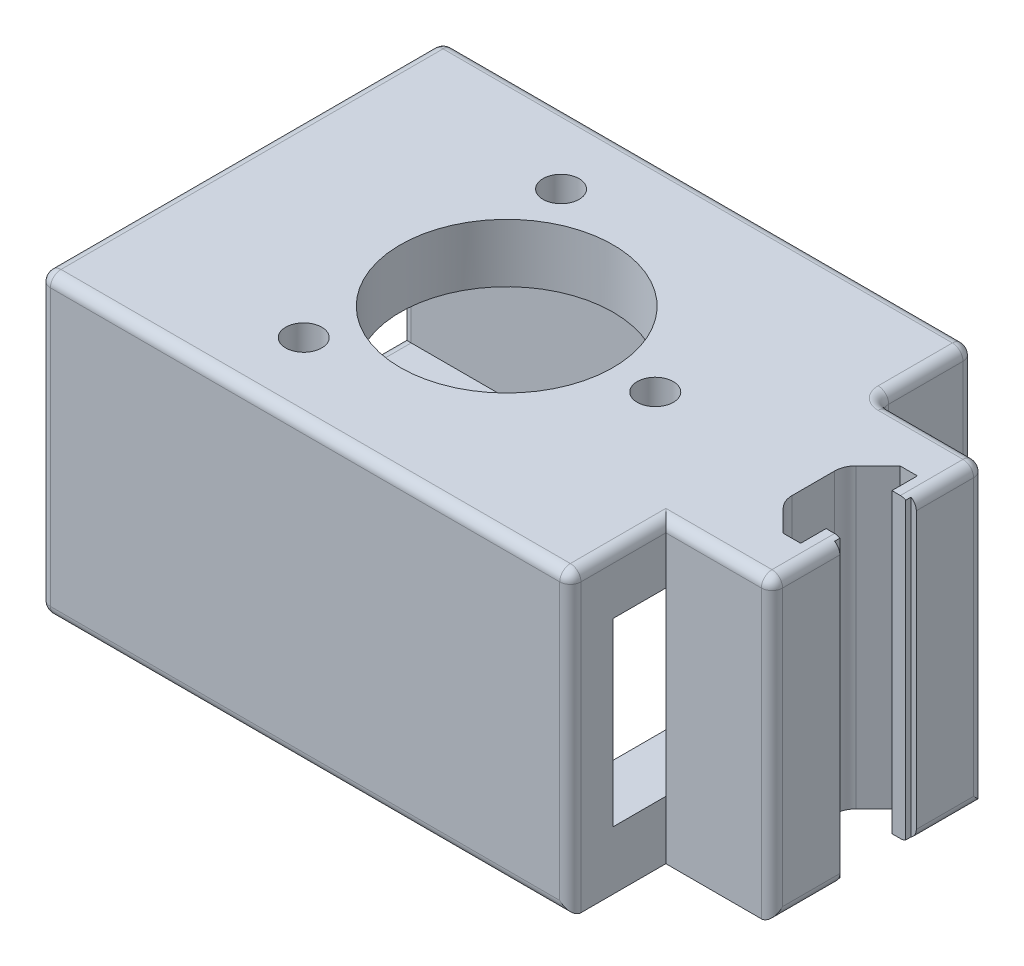
from build123d import *

# Parameters (mm, degrees)
SKETCH2_W                      = 30
SKETCH2_H                      = 17
BOSS_EXTRUDE1_DEPTH            = 50
CUT_EXTRUDE4_REACH             = 64.33
SKETCH7_R                      = 10.025
F_3_0MM_DOWEL_HOLE1_D          = 3.4
F_3_0MM_DOWEL_HOLE1_DEPTH      = 5.5
BOSS_EXTRUDE2_REACH            = 62.374
FILLET1_R                      = 1
CUT_EXTRUDE7_REACH             = 70.884
SKETCH13_W                     = 33.931840249
SKETCH13_H                     = 30
CUT_EXTRUDE7_DIRECTION_2_DEPTH = 10


with BuildPart() as part:
    # Sketch2 → Boss-Extrude1 (new body)
    with BuildSketch(Plane(origin=(0, 0, 0), x_dir=(0, 0, -1), z_dir=(1, 0, 0))):
        Polygon((19, -14), (3.999996995, -14), (0, -17.999996995), (-3.999996995, -14), (-19, -14), (-19, 14), (19, 14), align=None)
        Rectangle(SKETCH2_W, SKETCH2_H, mode=Mode.SUBTRACT)
    extrude(amount=BOSS_EXTRUDE1_DEPTH)

    # Sketch7 → Cut-Extrude4 (cut, up to next)
    with BuildSketch(Plane(origin=(0, 14, 0), x_dir=(1, 0, 0), z_dir=(0, 1, 0)), mode=Mode.PRIVATE) as cut_extrude4_sk1:
        with Locations(Location((25, 0, 0), (0, 0, 270))):
            Circle(SKETCH7_R)
    cut_extrude4_tool1 = extrude(cut_extrude4_sk1.sketch, amount=-CUT_EXTRUDE4_REACH, mode=Mode.PRIVATE) & part.part
    add(cut_extrude4_tool1.solids().sort_by_distance((25, 14, 0))[0], mode=Mode.SUBTRACT)

    # Ø3.0mm Dowel Hole1
    with Locations(Plane(origin=(0, 14, 0), x_dir=(1, 0, 0), z_dir=(0, 1, 0))):
        with Locations((18, -12.124355653), (18, 12.124355653), (39, 0)):
            Hole(F_3_0MM_DOWEL_HOLE1_D / 2, depth=F_3_0MM_DOWEL_HOLE1_DEPTH)

    # Boss-Extrude2: up to this face of the body (flat: up to its plane)
    boss_extrude2_end = Plane(part.part.faces().sort_by_distance((25, 14, 18.371987261))[0])
    # Sketch6 → Boss-Extrude2 (add, up to the picked face)
    with BuildSketch(Plane(origin=(0, -14, 0), x_dir=(1, 0, 0), z_dir=(0, 1, 0)), mode=Mode.PRIVATE) as boss_extrude2_sk1:
        with BuildLine():
            Line((60, 3.6), (59.5, 3.6))
            Line((59.5, 3.6), (59.5, 3.1))
            Line((59.5, 3.1), (58.2, 3.1))
            Line((58.2, 3.1), (58.2, 5.5))
            Line((58.2, 5.5), (56.560660172, 5.5))
            Line((56.560660172, 5.5), (54.485786438, 3.425126266))
            ThreePointArc((54.485786438, 3.425126266), (54.052240935, 2.776279568), (53.9, 2.010912703))
            Line((53.9, 2.010912703), (53.9, -2.010912703))
            ThreePointArc((53.9, -2.010912703), (54.052240935, -2.776279568), (54.485786438, -3.425126266))
            Line((54.485786438, -3.425126266), (56.560660172, -5.5))
            Line((56.560660172, -5.5), (58.2, -5.5))
            Line((58.2, -5.5), (58.2, -3.1))
            Line((58.2, -3.1), (59.5, -3.1))
            Line((59.5, -3.1), (59.5, -3.6))
            Line((59.5, -3.6), (60, -3.6))
            Line((60, -3.6), (60, -10))
            Line((60, -10), (50, -10))
            Line((50, -10), (50, 10))
            Line((50, 10), (60, 10))
            Line((60, 10), (60, 3.6))
        make_face()
    boss_extrude2_tool1 = split(extrude(boss_extrude2_sk1.sketch, amount=BOSS_EXTRUDE2_REACH, mode=Mode.PRIVATE), bisect_by=boss_extrude2_end, keep=Keep.BOTH, mode=Mode.PRIVATE)
    add(boss_extrude2_tool1.solids().sort_by(Axis((59.75, -14, -3.823607), (0, 1, 0)))[0])

    # Fillet1
    fillet1_edges = [part.edges().sort_by_distance(p)[0] for p in [
        (55, 14, -10),
        (0, -8.5, 0),
        (0, 0, 15),
        (0, 8.5, 0),
        (0, 0, -15),
        (0, -14, 11.499998498),
        (0, -15.999998498, 1.999998498),
        (0, -15.999998498, -1.999998498),
        (0, -14, -11.499998498),
        (0, 14, 0),
        (25, -14, -19),
        (50, 0, -19),
        (25, 14, -19),
        (0, 0, -19),
        (25, 14, 19),
        (50, 0, 19),
        (25, -14, 19),
        (0, 0, 19),
        (50, 14, -14.5),
        (50, 11.25, -10),
        (55, 14, 10),
        (50, 14, 14.5),
        (60, 0, -10),
        (60, 0, 10),
        (60, -14, 6.8),
        (60, -14, -6.8),
        (60, 14, 6.8),
        (60, 14, -6.8),
    ]]
    fillet(fillet1_edges, radius=FILLET1_R)

    # Sketch13 → Cut-Extrude7 (cut, up to next)
    with BuildSketch(Plane.XZ.offset(14), mode=Mode.PRIVATE) as cut_extrude7_sk1:
        with Locations((27.606274686, 0)):
            Rectangle(SKETCH13_W, SKETCH13_H)
    cut_extrude7_tool1 = extrude(cut_extrude7_sk1.sketch, amount=-CUT_EXTRUDE7_REACH, mode=Mode.PRIVATE) & part.part
    add(cut_extrude7_tool1.solids().sort_by_distance((27.606275, -14, 0))[0], mode=Mode.SUBTRACT)

    # Sketch13 → Cut-Extrude7 direction 2 (cut)
    with BuildSketch(Plane.XZ.offset(14)):
        with Locations((27.606274686, 0)):
            Rectangle(SKETCH13_W, SKETCH13_H)
    extrude(amount=CUT_EXTRUDE7_DIRECTION_2_DEPTH, mode=Mode.SUBTRACT)


solid = part.part
